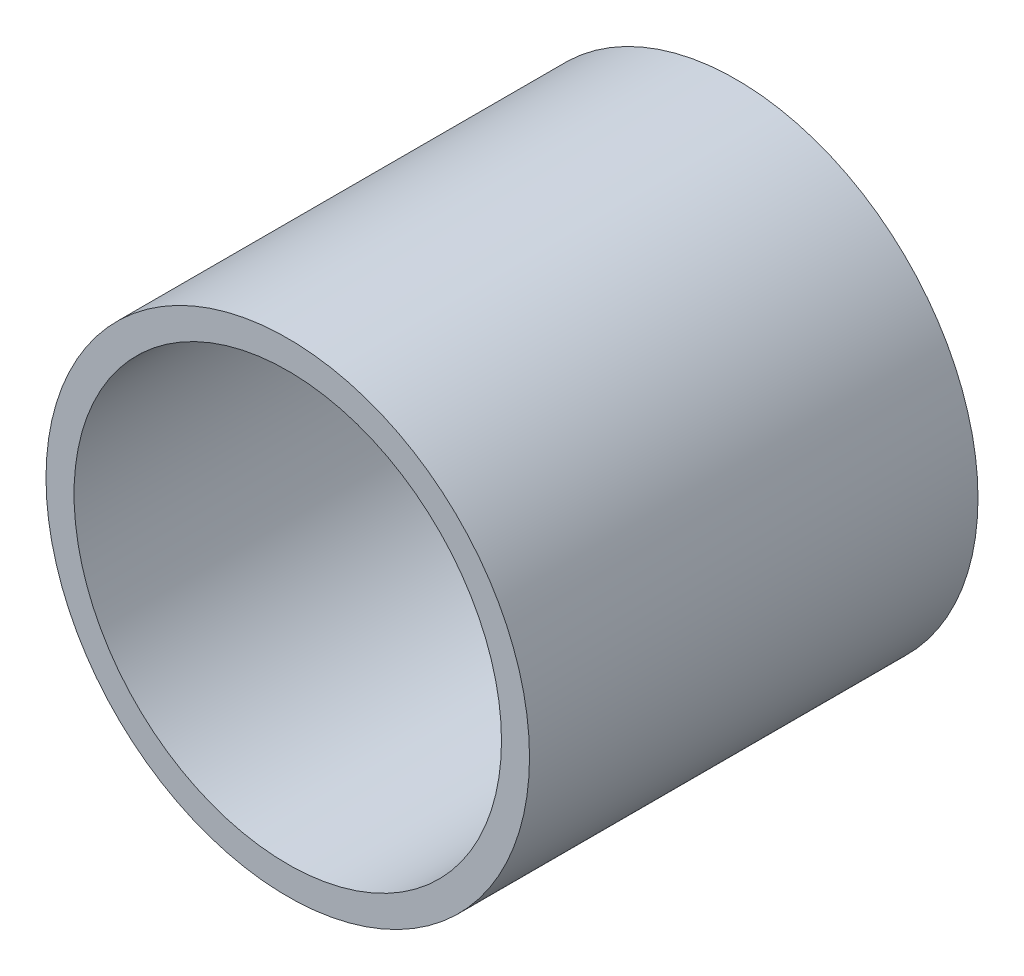
from build123d import *

# Parameters (mm, degrees)
SKETCH1_R           = 109.5375
SKETCH1_R_2         = 96.8375
EXTRUDE_THIN1_DEPTH = 101.6


with BuildPart() as part:
    # Sketch1 → Extrude-Thin1 (new, symmetric)
    with BuildSketch(Plane.XY):
        Circle(SKETCH1_R)
        Circle(SKETCH1_R_2, mode=Mode.SUBTRACT)
    extrude(amount=EXTRUDE_THIN1_DEPTH, both=True)


solid = part.part
